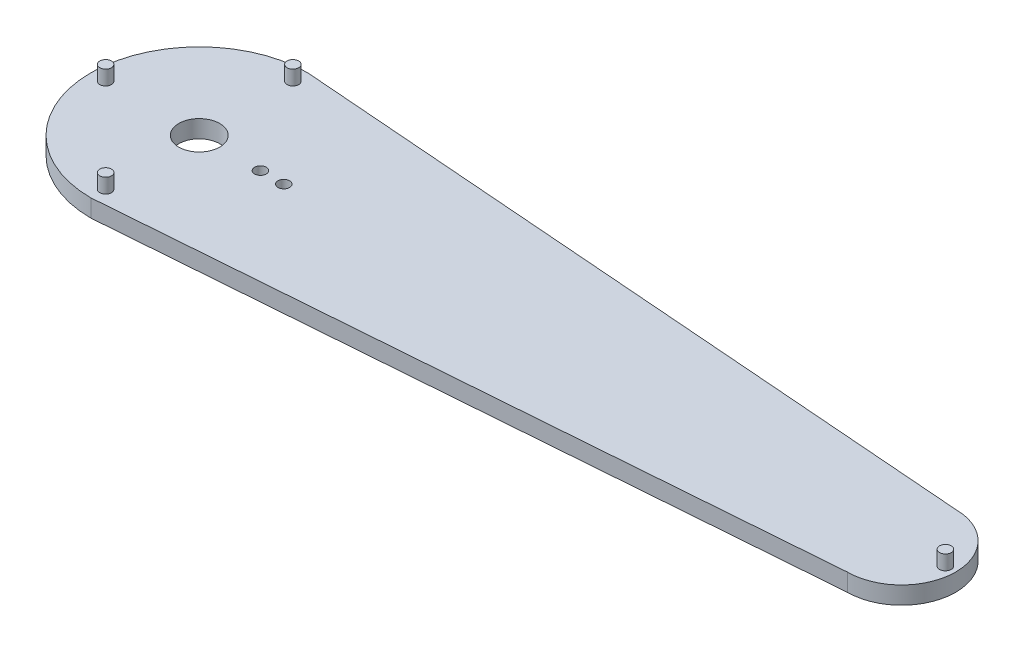
from build123d import *

# Parameters (mm, degrees)
SKETCH1_R           = 3.5
SKETCH1_R_2         = 1
BOSS_EXTRUDE1_DEPTH = 3
SKETCH2_R           = 1
BOSS_EXTRUDE2_DEPTH = 2.5


with BuildPart() as part:
    # Sketch1 → Boss-Extrude1 (new body)
    with BuildSketch(Plane(origin=(0, 0, 0), x_dir=(1, 0, 0), z_dir=(0, 1, 0))):
        with BuildLine():
            Line((0, 18.516950365), (120, 9.258475183))
            ThreePointArc((120, 9.258475183), (129.258475183, 0), (120, -9.258475183))
            Line((120, -9.258475183), (0, -18.516950365))
            ThreePointArc((0, -18.516950365), (-18.516950365, 0), (0, 18.516950365))
        make_face()
        with Locations(Location((0, 0, 0), (0, 0, 270))):
            Circle(SKETCH1_R, mode=Mode.SUBTRACT)
        with Locations(Location((14.45, 0, 0), (0, 0, 270))):
            Circle(SKETCH1_R_2, mode=Mode.SUBTRACT)
        with Locations(Location((10.45, 0, 0), (0, 0, 270))):
            Circle(SKETCH1_R_2, mode=Mode.SUBTRACT)
    extrude(amount=BOSS_EXTRUDE1_DEPTH)

    # Sketch2 → Boss-Extrude2 (add)
    with BuildSketch(Plane(origin=(0, 3, 0), x_dir=(1, 0, 0), z_dir=(0, 1, 0))):
        with Locations(Location((-16, 0, 0), (0, 0, 270))):
            Circle(SKETCH2_R)
        with Locations(Location((0, 16, 0), (0, 0, 270))):
            Circle(SKETCH2_R)
        with Locations(Location((0, -16, 0), (0, 0, 270))):
            Circle(SKETCH2_R)
        with Locations(Location((127.5, 0, 0), (0, 0, 270))):
            Circle(SKETCH2_R)
    extrude(amount=BOSS_EXTRUDE2_DEPTH)


solid = part.part
